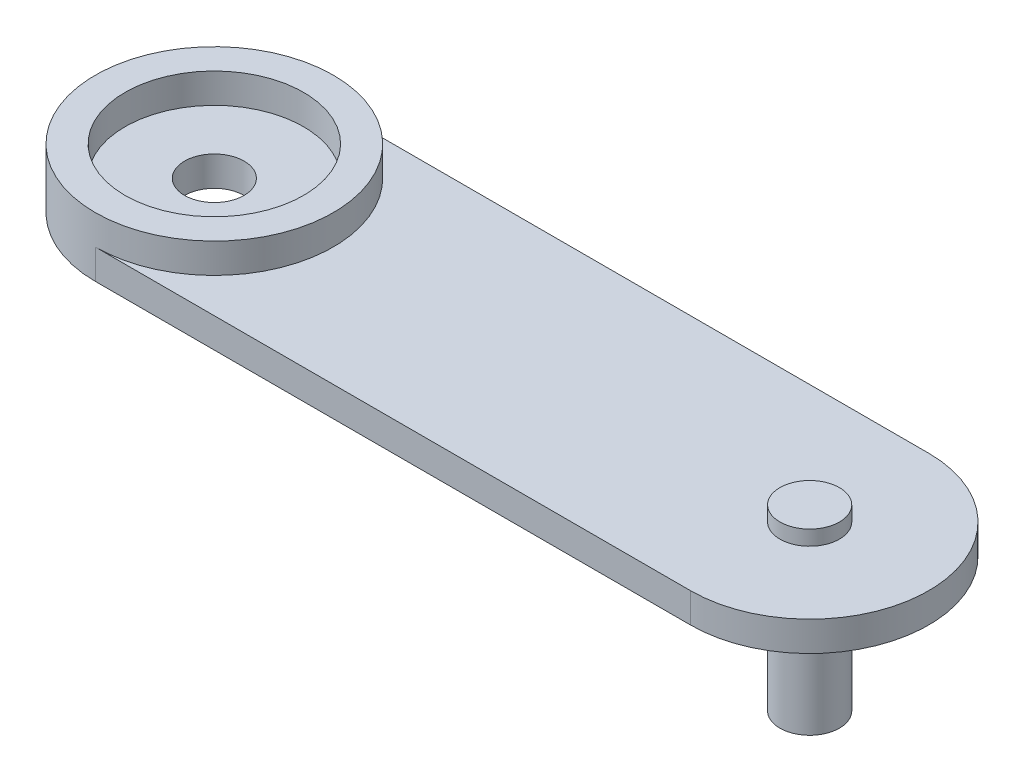
from build123d import *

# Parameters (mm, degrees)
BOSS_EXTRUDE1_DEPTH      = 10
SKETCH2_R                = 40
BOSS_EXTRUDE2_DEPTH      = 10
SKETCH3_R                = 30
CUT_EXTRUDE1_DEPTH       = 10
SKETCH4_R                = 10
CUT_EXTRUDE2_DEPTH       = 10
BOSS_EXTRUDE4_DEPTH      = 5
BOSS_EXTRUDE4_DEPTH_BACK = 55
SKETCH5_R                = 10


with BuildPart() as part:
    # Sketch1 → Boss-Extrude1 (new body)
    with BuildSketch(Plane(origin=(0, 0, 0), x_dir=(1, 0, 0), z_dir=(0, 1, 0))):
        with BuildLine():
            Line((-200, 40), (0, 40))
            ThreePointArc((0, 40), (40, 0), (0, -40))
            Line((0, -40), (-200, -40))
            ThreePointArc((-200, -40), (-240, 0), (-200, 40))
        make_face()
    extrude(amount=BOSS_EXTRUDE1_DEPTH)

    # Sketch2 → Boss-Extrude2 (add)
    with BuildSketch(Plane(origin=(0, 10, 0), x_dir=(1, 0, 0), z_dir=(0, 1, 0))):
        with Locations(Location((-200, 0, 0), (0, 0, 270))):
            Circle(SKETCH2_R)
    extrude(amount=BOSS_EXTRUDE2_DEPTH)

    # Sketch3 → Cut-Extrude1 (cut)
    with BuildSketch(Plane(origin=(0, 20, 0), x_dir=(1, 0, 0), z_dir=(0, 1, 0))):
        with Locations(Location((-200, 0, 0), (0, 0, 270))):
            Circle(SKETCH3_R)
    extrude(amount=-CUT_EXTRUDE1_DEPTH, mode=Mode.SUBTRACT)

    # Sketch4 → Cut-Extrude2 (cut)
    with BuildSketch(Plane(origin=(0, 10, 0), x_dir=(1, 0, 0), z_dir=(0, 1, 0))):
        with Locations(Location((-200, 0, 0), (0, 0, 270))):
            Circle(SKETCH4_R)
    extrude(amount=-CUT_EXTRUDE2_DEPTH, mode=Mode.SUBTRACT)

    # Sketch5 → Boss-Extrude4 (add, two sides: drawn at the far end of the back side and taken through both)
    with BuildSketch(Plane(origin=(0, 10, 0), x_dir=(1, 0, 0), z_dir=(0, 1, 0)).offset(-BOSS_EXTRUDE4_DEPTH_BACK)):
        with Locations(Location((0, 0, 0), (0, 0, 270))):
            Circle(SKETCH5_R)
    extrude(amount=BOSS_EXTRUDE4_DEPTH + BOSS_EXTRUDE4_DEPTH_BACK)


solid = part.part
